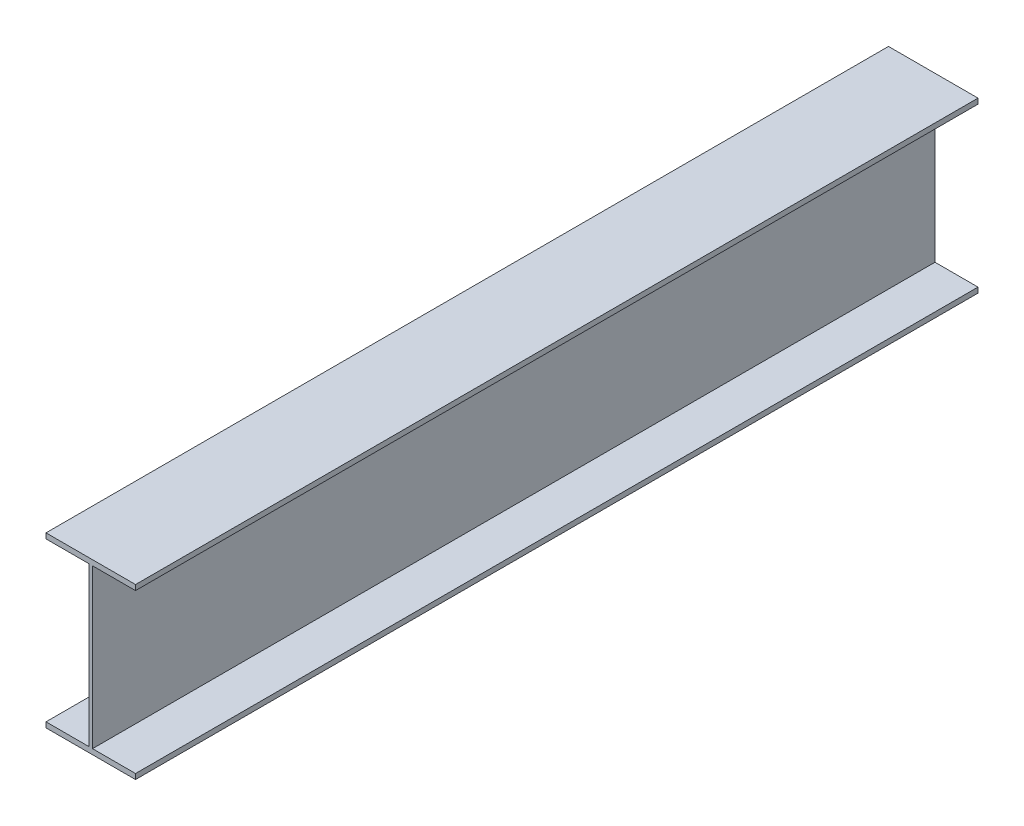
from build123d import *

# Parameters (mm, degrees)
BOSS_EXTRUDE1_DEPTH = 3048


with BuildPart() as part:
    # Sketch1 → Boss-Extrude1 (new body)
    with BuildSketch(Plane.XY):
        Polygon((-6.35, 305.562), (-161.925, 305.562), (-161.925, 286.512), (-6.35, 286.512), (-6.35, -286.512), (-161.925, -286.512), (-161.925, -305.562), (-6.35, -305.562), (6.35, -305.562), (161.925, -305.562), (161.925, -286.512), (6.35, -286.512), (6.35, 286.512), (161.925, 286.512), (161.925, 305.562), (6.35, 305.562), align=None)
    extrude(amount=BOSS_EXTRUDE1_DEPTH)


solid = part.part
